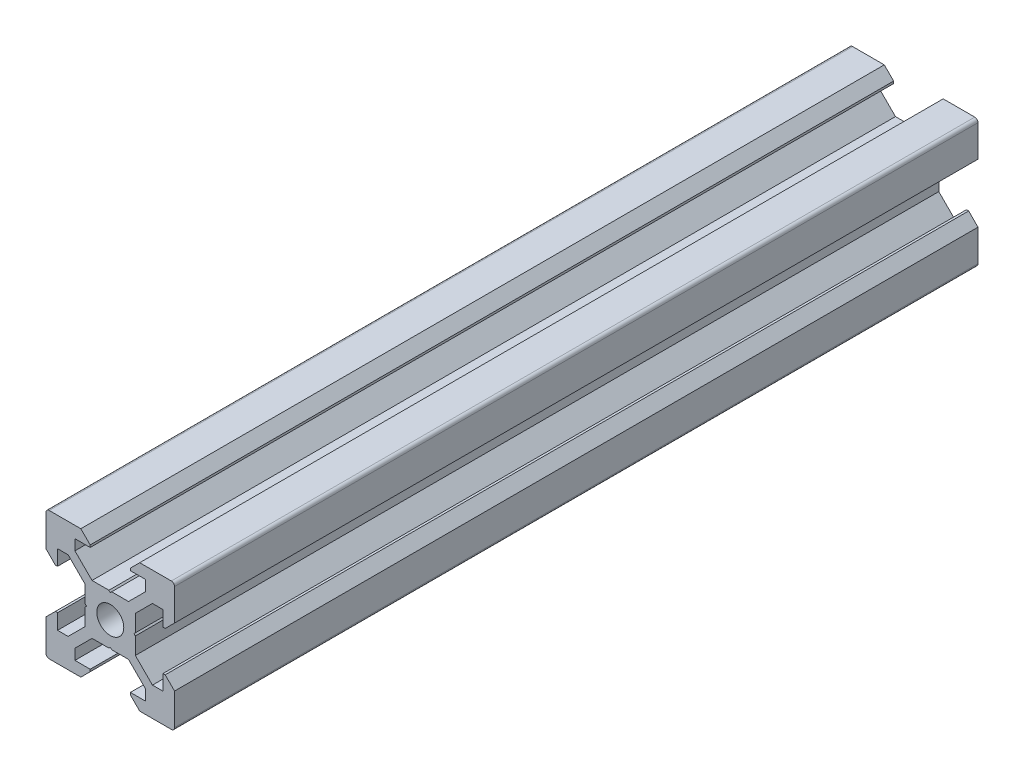
from build123d import *

# Parameters (mm, degrees)
SKETCH1_R           = 2.1
BOSS_EXTRUDE1_DEPTH = 125


with BuildPart() as part:
    # Sketch1 → Boss-Extrude1 (new body)
    with BuildSketch(Plane.XY):
        with BuildLine():
            Line((4.58, -10), (9.5, -10))
            ThreePointArc((9.5, -10), (9.853553391, -9.853553391), (10, -9.5))
            Line((10, -9.5), (10, -4.58))
            Line((10, -4.58), (8.545, -3.125))
            Line((8.545, -3.125), (8.2, -3.125))
            Line((8.2, -3.125), (8.2, -5.5))
            Line((8.2, -5.5), (6.560660172, -5.5))
            Line((6.560660172, -5.5), (3.9, -2.839339828))
            Line((3.9, -2.839339828), (3.9, -0.21))
            Line((3.9, -0.21), (3.69, 0))
            Line((3.69, 0), (3.9, 0.21))
            Line((3.9, 0.21), (3.9, 2.839339828))
            Line((3.9, 2.839339828), (6.560660172, 5.5))
            Line((6.560660172, 5.5), (8.2, 5.5))
            Line((8.2, 5.5), (8.2, 3.125))
            Line((8.2, 3.125), (8.545, 3.125))
            Line((8.545, 3.125), (10, 4.58))
            Line((10, 4.58), (10, 9.5))
            ThreePointArc((10, 9.5), (9.853553391, 9.853553391), (9.5, 10))
            Line((9.5, 10), (4.58, 10))
            Line((4.58, 10), (3.125, 8.545))
            Line((3.125, 8.545), (3.125, 8.2))
            Line((3.125, 8.2), (5.5, 8.2))
            Line((5.5, 8.2), (5.5, 6.560660172))
            Line((5.5, 6.560660172), (2.839339828, 3.9))
            Line((2.839339828, 3.9), (0.21, 3.9))
            Line((0.21, 3.9), (0, 3.69))
            Line((0, 3.69), (-0.21, 3.9))
            Line((-0.21, 3.9), (-2.839339828, 3.9))
            Line((-2.839339828, 3.9), (-5.5, 6.560660172))
            Line((-5.5, 6.560660172), (-5.5, 8.2))
            Line((-5.5, 8.2), (-3.125, 8.2))
            Line((-3.125, 8.2), (-3.125, 8.545))
            Line((-3.125, 8.545), (-4.58, 10))
            Line((-4.58, 10), (-9.5, 10))
            ThreePointArc((-9.5, 10), (-9.853553391, 9.853553391), (-10, 9.5))
            Line((-10, 9.5), (-10, 4.58))
            Line((-10, 4.58), (-8.545, 3.125))
            Line((-8.545, 3.125), (-8.2, 3.125))
            Line((-8.2, 3.125), (-8.2, 5.5))
            Line((-8.2, 5.5), (-6.560660172, 5.5))
            Line((-6.560660172, 5.5), (-3.9, 2.839339828))
            Line((-3.9, 2.839339828), (-3.9, 0.21))
            Line((-3.9, 0.21), (-3.69, 0))
            Line((-3.69, 0), (-3.9, -0.21))
            Line((-3.9, -0.21), (-3.9, -2.839339828))
            Line((-3.9, -2.839339828), (-6.560660172, -5.5))
            Line((-6.560660172, -5.5), (-8.2, -5.5))
            Line((-8.2, -5.5), (-8.2, -3.125))
            Line((-8.2, -3.125), (-8.545, -3.125))
            Line((-8.545, -3.125), (-10, -4.58))
            Line((-10, -4.58), (-10, -9.5))
            ThreePointArc((-10, -9.5), (-9.853553391, -9.853553391), (-9.5, -10))
            Line((-9.5, -10), (-4.58, -10))
            Line((-4.58, -10), (-3.125, -8.545))
            Line((-3.125, -8.545), (-3.125, -8.2))
            Line((-3.125, -8.2), (-5.5, -8.2))
            Line((-5.5, -8.2), (-5.5, -6.560660172))
            Line((-5.5, -6.560660172), (-2.839339828, -3.9))
            Line((-2.839339828, -3.9), (-0.21, -3.9))
            Line((-0.21, -3.9), (0, -3.69))
            Line((0, -3.69), (0.21, -3.9))
            Line((0.21, -3.9), (2.839339828, -3.9))
            Line((2.839339828, -3.9), (5.5, -6.560660172))
            Line((5.5, -6.560660172), (5.5, -8.2))
            Line((5.5, -8.2), (3.125, -8.2))
            Line((3.125, -8.2), (3.125, -8.545))
            Line((3.125, -8.545), (4.58, -10))
        make_face()
        Circle(SKETCH1_R, mode=Mode.SUBTRACT)
    extrude(amount=BOSS_EXTRUDE1_DEPTH)


solid = part.part
